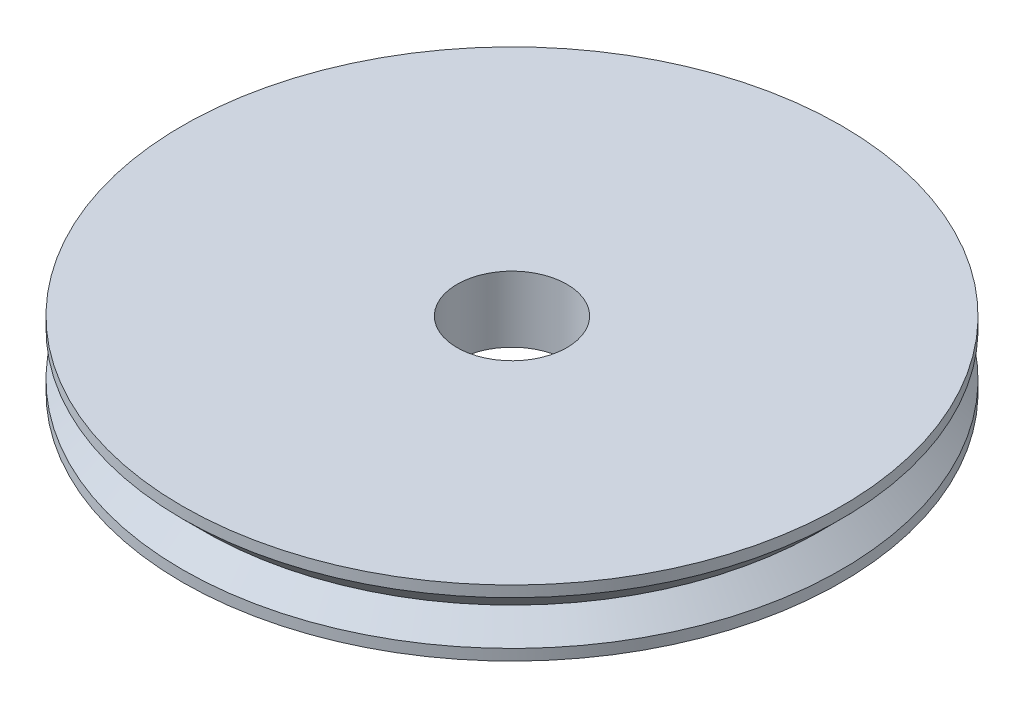
from build123d import *


with BuildPart() as part:
    # Sketch1 → Revolve1 (revolve)
    with BuildSketch(Plane.XY, mode=Mode.PRIVATE) as revolve1_sk:
        Polygon((-2.5, 0), (-2.5, 3), (-15, 3), (-15, 2.5), (-14, 1.5), (-15, 0.5), (-15, 0), align=None)
    revolve(revolve1_sk.sketch.rotate(Axis((0, 0, 0), (0, 1, 0)), 270), axis=Axis((0, 0, 0), (0, 1, 0)))


solid = part.part
